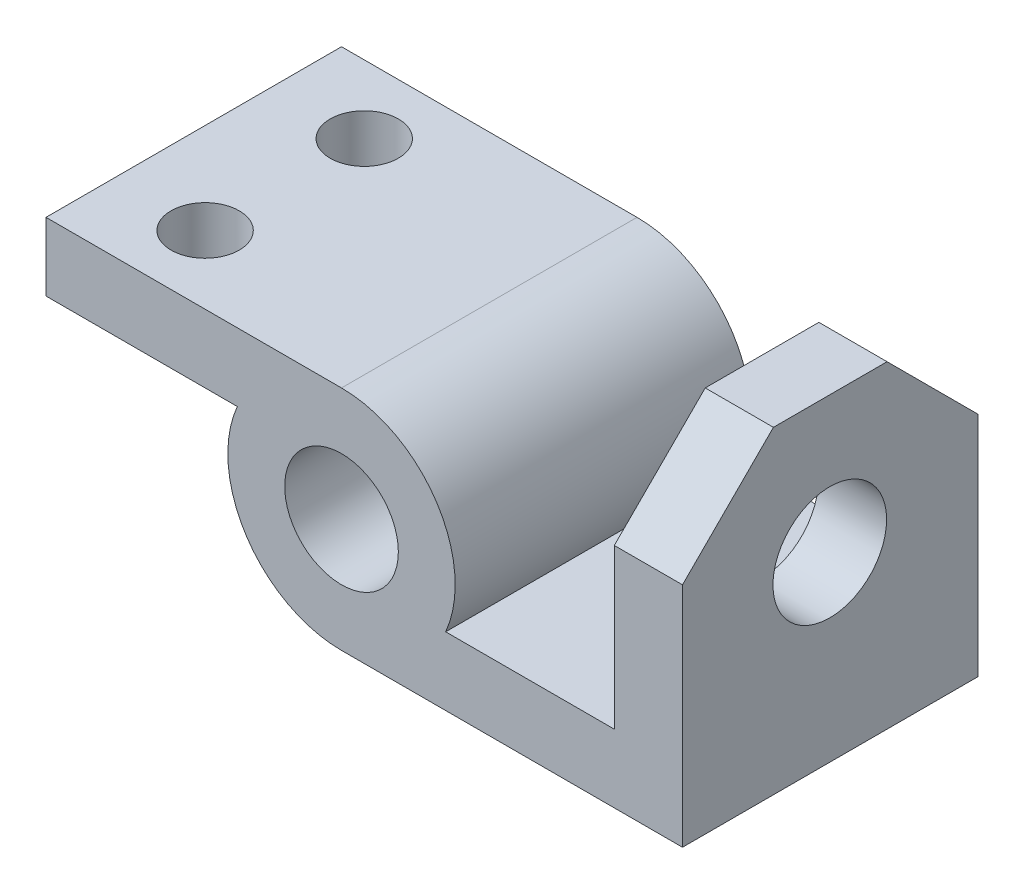
from build123d import *

# Parameters (mm, degrees)
BOSS_EXTRUDE1_DEPTH = 3250
SKETCH2_R           = 625
CUT_EXTRUDE1_DEPTH  = 5449.623679426
CUT_EXTRUDE2_REACH  = 5558.528
SKETCH3_R           = 375
CUT_EXTRUDE3_REACH  = 8040.968
SKETCH4_R           = 625
CHAMFER1_SIZE       = 1000


with BuildPart() as part:
    # Sketch1 → Boss-Extrude1 (new body)
    with BuildSketch(Plane.XY):
        with BuildLine():
            Line((0, 1250), (-3250, 1250))
            Line((-3250, 1250), (-3250, 500))
            Line((-3250, 500), (-1145.643923739, 500))
            ThreePointArc((-1145.643923739, 500), (-1045.825033168, -684.653196881), (0, -1250))
            Line((0, -1250), (3750, -1250))
            Line((3750, -1250), (3750, 2250))
            Line((3750, 2250), (3000, 2250))
            Line((3000, 2250), (3000, -500))
            Line((3000, -500), (1145.643923739, -500))
            ThreePointArc((1145.643923739, -500), (1045.825033168, 684.653196881), (0, 1250))
        make_face()
    extrude(amount=BOSS_EXTRUDE1_DEPTH)

    # Sketch2 → Cut-Extrude1 (cut, through all)
    with BuildSketch(Plane.XY.offset(3250)):
        Circle(SKETCH2_R)
    extrude(amount=-CUT_EXTRUDE1_DEPTH, mode=Mode.SUBTRACT)

    # Sketch3 → Cut-Extrude2 (cut, up to next)
    with BuildSketch(Plane(origin=(0, 1250, 0), x_dir=(1, 0, 0), z_dir=(0, 1, 0)), mode=Mode.PRIVATE) as cut_extrude2_sk1:
        with Locations(Location((-2250, -2500, 0), (0, 0, 180))):
            Circle(SKETCH3_R)
    cut_extrude2_tool1 = extrude(cut_extrude2_sk1.sketch, amount=-CUT_EXTRUDE2_REACH, mode=Mode.PRIVATE) & part.part
    # Sketch3 → Cut-Extrude2 (cut, up to next)
    with BuildSketch(Plane(origin=(0, 1250, 0), x_dir=(1, 0, 0), z_dir=(0, 1, 0)), mode=Mode.PRIVATE) as cut_extrude2_sk2:
        with Locations(Location((-2250, -750, 0), (0, 0, 180))):
            Circle(SKETCH3_R)
    cut_extrude2_tool2 = extrude(cut_extrude2_sk2.sketch, amount=-CUT_EXTRUDE2_REACH, mode=Mode.PRIVATE) & part.part
    add(cut_extrude2_tool1.solids().sort_by_distance((-2250, 1250, 2500))[0], mode=Mode.SUBTRACT)
    add(cut_extrude2_tool2.solids().sort_by_distance((-2250, 1250, 750))[0], mode=Mode.SUBTRACT)

    # Sketch4 → Cut-Extrude3 (cut, up to next)
    with BuildSketch(Plane(origin=(3750, 0, 0), x_dir=(0, 0, -1), z_dir=(1, 0, 0)), mode=Mode.PRIVATE) as cut_extrude3_sk1:
        with Locations((-1630, 750)):
            Circle(SKETCH4_R)
    cut_extrude3_tool1 = extrude(cut_extrude3_sk1.sketch, amount=-CUT_EXTRUDE3_REACH, mode=Mode.PRIVATE) & part.part
    add(cut_extrude3_tool1.solids().sort_by_distance((3750, 750, 1630))[0], mode=Mode.SUBTRACT)

    # Chamfer1
    chamfer1_edges = [part.edges().sort_by_distance(p)[0] for p in [
        (3375, 2250, 0),
        (3375, 2250, 3250),
    ]]
    chamfer(chamfer1_edges, length=CHAMFER1_SIZE)


solid = part.part
